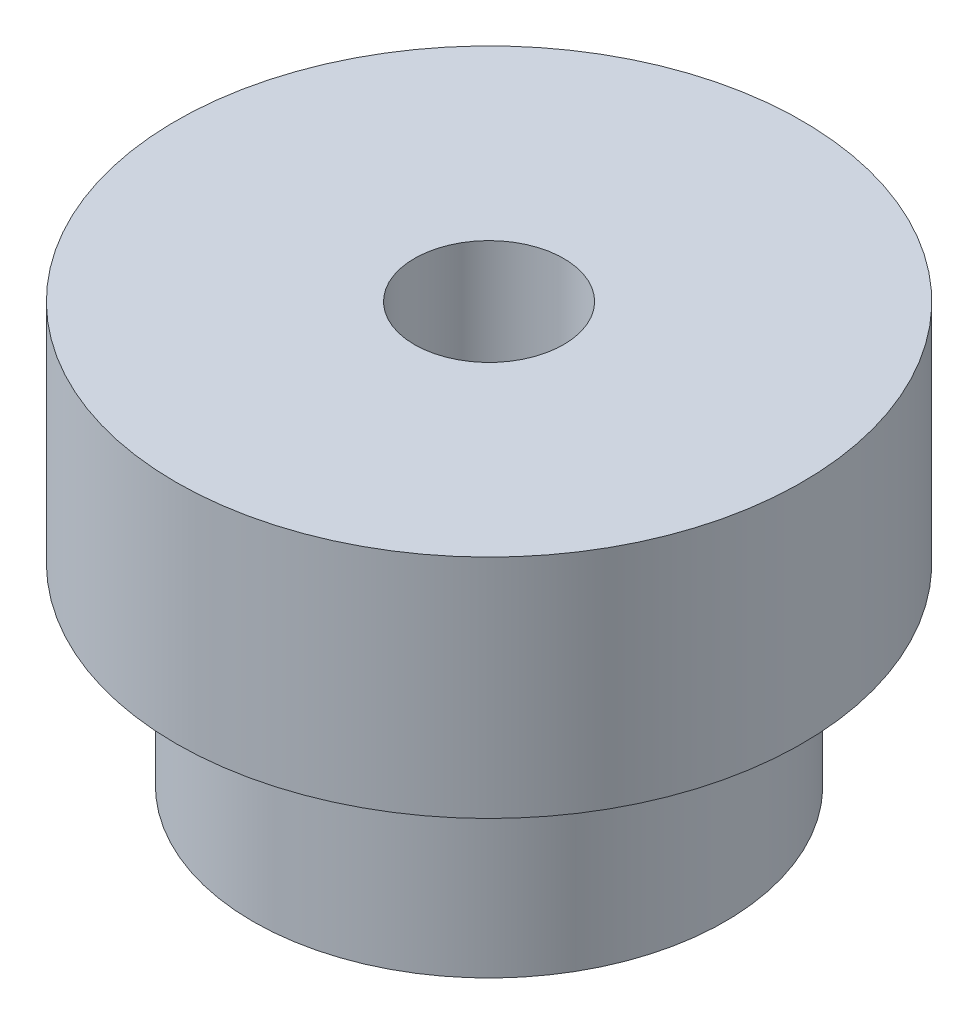
from build123d import *

# Parameters (mm, degrees)
SKETCH1_R           = 12.446
BOSS_EXTRUDE1_DEPTH = 10.16
SKETCH2_R           = 16.51
BOSS_EXTRUDE2_DEPTH = 11.938
SKETCH3_R           = 3.937
CUT_EXTRUDE1_DEPTH  = 33.147811807


with BuildPart() as part:
    # Sketch1 → Boss-Extrude1 (new body)
    with BuildSketch(Plane(origin=(0, 0, 0), x_dir=(1, 0, 0), z_dir=(0, 1, 0))):
        with Locations(Location((0, 0, 0), (0, 0, 270))):
            Circle(SKETCH1_R)
    extrude(amount=BOSS_EXTRUDE1_DEPTH)

    # Sketch2 → Boss-Extrude2 (add)
    with BuildSketch(Plane(origin=(0, 10.16, 0), x_dir=(1, 0, 0), z_dir=(0, 1, 0))):
        with Locations(Location((0, 0, 0), (0, 0, 270))):
            Circle(SKETCH2_R)
    extrude(amount=BOSS_EXTRUDE2_DEPTH)

    # Sketch3 → Cut-Extrude1 (cut, through all)
    with BuildSketch(Plane(origin=(0, 22.098, 0), x_dir=(1, 0, 0), z_dir=(0, 1, 0))):
        with Locations(Location((0, 0, 0), (0, 0, 270))):
            Circle(SKETCH3_R)
    extrude(amount=-CUT_EXTRUDE1_DEPTH, mode=Mode.SUBTRACT)


solid = part.part
